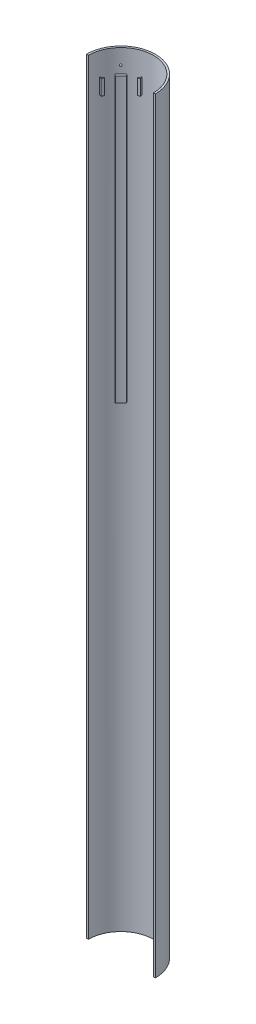
from build123d import *

# Parameters (mm, degrees)
EXTRUDE_1_DEPTH     = 1000
EXTRUDE_START       = -400
EXTRUDE_3_DEPTH     = 370
EXTRUDE_START_2     = -50
EXTRUDE_4_DEPTH     = 20
CUT_EXTRUDE_START   = -20
CUT_EXTRUDE_1_DEPTH = 20
SKETCH_8_R          = 2.7
CUT_EXTRUDE_4_DEPTH = 2
SKETCH_9_R          = 1.25
CUT_EXTRUDE_5_DEPTH = 6
SKETCH_10_R         = 2.7
CUT_EXTRUDE_6_DEPTH = 2
SKETCH_11_R         = 1.25
CUT_EXTRUDE_7_DEPTH = 6


with BuildPart() as part:
    # 草图1 → 凸台-拉伸1 (new body)
    with BuildSketch(Plane(origin=(0, 0, 0), x_dir=(1, 0, 0), z_dir=(0, 1, 0))):
        with BuildLine():
            Line((-45, 0), (-42.5, 0))
            ThreePointArc((-42.5, 0), (0, 42.5), (42.5, 0))
            Line((42.5, 0), (45, 0))
            ThreePointArc((45, 0), (0, 45), (-45, 0))
        make_face()
    extrude(amount=EXTRUDE_1_DEPTH)

    # 草图3 → 凸台-拉伸3 (add)
    with BuildSketch(Plane(origin=(0, 1000, 0), x_dir=(1, 0, 0), z_dir=(0, 1, 0)).offset(EXTRUDE_START)):
        with BuildLine():
            Line((-31.337456942, 24.046076446), (-33.717516962, 25.872360733))
            ThreePointArc((-33.717516962, 25.872360733), (-30.0520382, 30.0520382), (-25.872360733, 33.717516962))
            Line((-25.872360733, 33.717516962), (-24.046076446, 31.337456942))
            ThreePointArc((-24.046076446, 31.337456942), (-27.930717857, 27.930717857), (-31.337456942, 24.046076446))
        make_face()
        with BuildLine():
            Line((24.046076446, 31.337456942), (25.872360733, 33.717516962))
            ThreePointArc((25.872360733, 33.717516962), (30.0520382, 30.0520382), (33.717516962, 25.872360733))
            Line((33.717516962, 25.872360733), (31.337456942, 24.046076446))
            ThreePointArc((31.337456942, 24.046076446), (27.930717857, 27.930717857), (24.046076446, 31.337456942))
        make_face()
    extrude(amount=EXTRUDE_3_DEPTH)

    # 草图4 → 凸台-拉伸4 (add)
    with BuildSketch(Plane(origin=(0, 1000, 0), x_dir=(1, 0, 0), z_dir=(0, 1, 0)).offset(EXTRUDE_START_2)):
        with BuildLine():
            Line((-37.671819555, 11.87787908), (-40.532970407, 12.779996479))
            ThreePointArc((-40.532970407, 12.779996479), (-39.962245398, 14.466130884), (-39.321413031, 16.12688678))
            Line((-39.321413031, 16.12688678), (-36.545783876, 14.988518301))
            ThreePointArc((-36.545783876, 14.988518301), (-37.141381017, 13.444992233), (-37.671819555, 11.87787908))
        make_face()
        with BuildLine():
            Line((36.545783876, 14.988518301), (39.321413031, 16.12688678))
            ThreePointArc((39.321413031, 16.12688678), (39.962245398, 14.466130884), (40.532970407, 12.779996479))
            Line((40.532970407, 12.779996479), (37.671819555, 11.87787908))
            ThreePointArc((37.671819555, 11.87787908), (37.141381017, 13.444992233), (36.545783876, 14.988518301))
        make_face()
        with BuildLine():
            Line((11.87787908, 37.671819555), (12.779996479, 40.532970407))
            ThreePointArc((12.779996479, 40.532970407), (14.466130884, 39.962245398), (16.12688678, 39.321413031))
            Line((16.12688678, 39.321413031), (14.988518301, 36.545783876))
            ThreePointArc((14.988518301, 36.545783876), (13.444992233, 37.141381017), (11.87787908, 37.671819555))
        make_face()
        with BuildLine():
            Line((-14.988518301, 36.545783876), (-16.12688678, 39.321413031))
            ThreePointArc((-16.12688678, 39.321413031), (-14.466130884, 39.962245398), (-12.779996479, 40.532970407))
            Line((-12.779996479, 40.532970407), (-11.87787908, 37.671819555))
            ThreePointArc((-11.87787908, 37.671819555), (-13.444992233, 37.141381017), (-14.988518301, 36.545783876))
        make_face()
    extrude(amount=EXTRUDE_4_DEPTH)

    # 草图5 → 切除-拉伸1 (cut)
    with BuildSketch(Plane(origin=(0, 970, 0), x_dir=(1, 0, 0), z_dir=(0, 1, 0)).offset(CUT_EXTRUDE_START)):
        with BuildLine():
            Line((-38.293502312, 13.185510256), (-40.184539463, 13.836646564))
            ThreePointArc((-40.184539463, 13.836646564), (-39.769465933, 14.987981166), (-39.321413031, 16.12688678))
            Line((-39.321413031, 16.12688678), (-37.444114361, 15.433350242))
            ThreePointArc((-37.444114361, 15.433350242), (-37.885483249, 14.315731173), (-38.293502312, 13.185510256))
        make_face()
        with BuildLine():
            Line((-15.433350242, 37.444114361), (-16.12688678, 39.321413031))
            ThreePointArc((-16.12688678, 39.321413031), (-14.987981166, 39.769465933), (-13.836646564, 40.184539463))
            Line((-13.836646564, 40.184539463), (-13.185510256, 38.293502312))
            ThreePointArc((-13.185510256, 38.293502312), (-14.315731173, 37.885483249), (-15.433350242, 37.444114361))
        make_face()
        with BuildLine():
            Line((13.185510256, 38.293502312), (13.836646564, 40.184539463))
            ThreePointArc((13.836646564, 40.184539463), (14.987981166, 39.769465933), (16.12688678, 39.321413031))
            Line((16.12688678, 39.321413031), (15.433350242, 37.444114361))
            ThreePointArc((15.433350242, 37.444114361), (14.315731173, 37.885483249), (13.185510256, 38.293502312))
        make_face()
        with BuildLine():
            Line((37.444114361, 15.433350242), (39.321413031, 16.12688678))
            ThreePointArc((39.321413031, 16.12688678), (39.769465933, 14.987981166), (40.184539463, 13.836646564))
            Line((40.184539463, 13.836646564), (38.293502312, 13.185510256))
            ThreePointArc((38.293502312, 13.185510256), (37.885483249, 14.315731173), (37.444114361, 15.433350242))
        make_face()
    extrude(amount=CUT_EXTRUDE_1_DEPTH, mode=Mode.SUBTRACT)

    # 草图8 → 切除-拉伸4 (cut)
    with BuildSketch(Plane(origin=(-31.819805153, 0, -31.819805153), x_dir=(0, -1, 0), z_dir=(-0.7071067811865488, 0, -0.7071067811865464))):
        with Locations(Location((-980, 0, 0), (0, 0, 90))):
            Circle(SKETCH_8_R)
    extrude(amount=-CUT_EXTRUDE_4_DEPTH, mode=Mode.SUBTRACT)

    # 草图9 → 切除-拉伸5 (cut)
    with BuildSketch(Plane(origin=(-31.819805153, 0, -31.819805153), x_dir=(0, -1, 0), z_dir=(-0.7071067811865488, 0, -0.7071067811865464))):
        with Locations(Location((-980, 0, 0), (0, 0, 90))):
            Circle(SKETCH_9_R)
    extrude(amount=-CUT_EXTRUDE_5_DEPTH, mode=Mode.SUBTRACT)

    # 草图10 → 切除-拉伸6 (cut)
    with BuildSketch(Plane(origin=(31.819805153, 0, -31.819805153), x_dir=(0, -1, 0), z_dir=(0.7071067811865488, 0, -0.7071067811865464))):
        with Locations(Location((-980, 0, 0), (0, 0, 90))):
            Circle(SKETCH_10_R)
    extrude(amount=-CUT_EXTRUDE_6_DEPTH, mode=Mode.SUBTRACT)

    # 草图11 → 切除-拉伸7 (cut)
    with BuildSketch(Plane(origin=(31.819805153, 0, -31.819805153), x_dir=(0, -1, 0), z_dir=(0.7071067811865488, 0, -0.7071067811865464))):
        with Locations(Location((-980, 0, 0), (0, 0, 90))):
            Circle(SKETCH_11_R)
    extrude(amount=-CUT_EXTRUDE_7_DEPTH, mode=Mode.SUBTRACT)


solid = part.part
